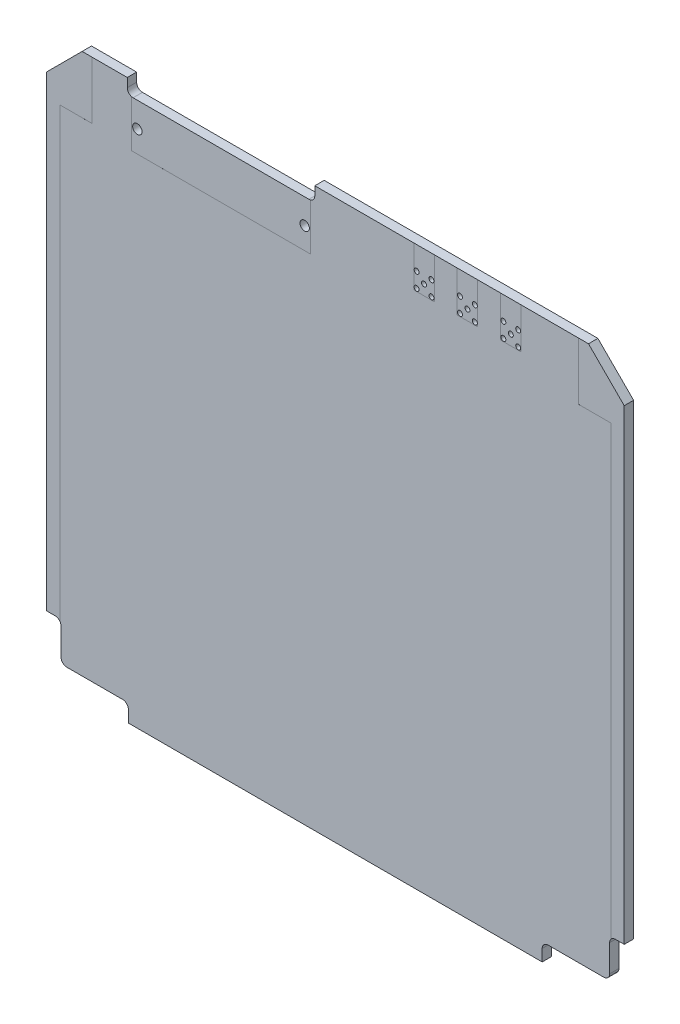
from build123d import *

# Parameters (mm, degrees)
SKETCH1_R           = 0.425
SKETCH1_R_2         = 0.8
BOSS_EXTRUDE1_DEPTH = 1.6
CUT_EXTRUDE1_DEPTH  = 0.0001
CUT_EXTRUDE2_DEPTH  = 0.0001
PARTFOOTPRINTS_W    = 30.48
PARTFOOTPRINTS_H    = 7.989227112
PARTFOOTPRINTS_W_2  = 3.5
PARTFOOTPRINTS_H_2  = 6.95
CUT_EXTRUDE3_DEPTH  = 0.0001


with BuildPart() as part:
    # Sketch1 → Boss-Extrude1 (new body)
    with BuildSketch(Plane(origin=(0, 0, -0.0125), x_dir=(-1, 0, 0), z_dir=(0, 0, -1))):
        with BuildLine():
            Line((35.3, -50), (35.3, -48))
            ThreePointArc((35.3, -48), (35.592893219, -47.292893219), (36.3, -47))
            Line((36.3, -47), (45.8, -47))
            ThreePointArc((45.8, -47), (46.507106781, -46.707106781), (46.8, -46))
            Line((46.8, -46), (46.8, -41.4))
            ThreePointArc((46.8, -41.4), (47.092893219, -40.692893219), (47.8, -40.4))
            Line((47.8, -40.4), (49.3, -40.4))
            Line((49.3, -40.4), (49.3, 39.2))
            Line((49.3, 39.2), (43.2, 45.3))
            Line((43.2, 45.3), (35.500000002, 45.3))
            Line((35.500000002, 45.3), (35.500000002, 43.8))
            ThreePointArc((35.500000002, 43.8), (35.207106783, 43.092893219), (34.500000002, 42.8))
            Line((34.500000002, 42.8), (4.499999998, 42.8))
            ThreePointArc((4.499999998, 42.8), (3.792893217, 43.092893219), (3.499999998, 43.8))
            Line((3.499999998, 43.8), (3.499999998, 45.3))
            Line((3.499999998, 45.3), (-43.2, 45.3))
            Line((-43.2, 45.3), (-49.3, 39.2))
            Line((-49.3, 39.2), (-49.3, -40.4))
            Line((-49.3, -40.4), (-47.8, -40.4))
            ThreePointArc((-47.8, -40.4), (-47.092893219, -40.692893219), (-46.8, -41.4))
            Line((-46.8, -41.4), (-46.8, -46))
            ThreePointArc((-46.8, -46), (-46.507106781, -46.707106781), (-45.8, -47))
            Line((-45.8, -47), (-36.3, -47))
            ThreePointArc((-36.3, -47), (-35.592893219, -47.292893219), (-35.3, -48))
            Line((-35.3, -48), (-35.3, -50))
            Line((-35.3, -50), (35.3, -50))
        make_face()
        with Locations(Location((-21.27, 41.37, 0), (0, 0, 180))):
            Circle(SKETCH1_R, mode=Mode.SUBTRACT)
        with Locations(Location((-23.81, 41.37, 0), (0, 0, 180))):
            Circle(SKETCH1_R, mode=Mode.SUBTRACT)
        with Locations(Location((-22.54, 40.1, 0), (0, 0, 180))):
            Circle(SKETCH1_R, mode=Mode.SUBTRACT)
        with Locations(Location((-13.87, 41.37, 0), (0, 0, 180))):
            Circle(SKETCH1_R, mode=Mode.SUBTRACT)
        with Locations(Location((-23.81, 38.83, 0), (0, 0, 180))):
            Circle(SKETCH1_R, mode=Mode.SUBTRACT)
        with Locations(Location((-16.41, 41.37, 0), (0, 0, 180))):
            Circle(SKETCH1_R, mode=Mode.SUBTRACT)
        with Locations(Location((-15.14, 40.1, 0), (0, 0, 180))):
            Circle(SKETCH1_R, mode=Mode.SUBTRACT)
        with Locations(Location((-21.27, 38.83, 0), (0, 0, 180))):
            Circle(SKETCH1_R, mode=Mode.SUBTRACT)
        with Locations(Location((-28.67, 41.37, 0), (0, 0, 180))):
            Circle(SKETCH1_R, mode=Mode.SUBTRACT)
        with Locations(Location((-31.21, 41.37, 0), (0, 0, 180))):
            Circle(SKETCH1_R, mode=Mode.SUBTRACT)
        with Locations(Location((-16.41, 38.83, 0), (0, 0, 180))):
            Circle(SKETCH1_R, mode=Mode.SUBTRACT)
        with Locations(Location((-29.94, 40.1, 0), (0, 0, 180))):
            Circle(SKETCH1_R, mode=Mode.SUBTRACT)
        with Locations(Location((-31.21, 38.83, 0), (0, 0, 180))):
            Circle(SKETCH1_R, mode=Mode.SUBTRACT)
        with Locations(Location((-28.67, 38.83, 0), (0, 0, 180))):
            Circle(SKETCH1_R, mode=Mode.SUBTRACT)
        with Locations(Location((33.775, 38.54, 0), (0, 0, 180))):
            Circle(SKETCH1_R_2, mode=Mode.SUBTRACT)
        with Locations((5.225, 38.54)):
            Circle(SKETCH1_R_2, mode=Mode.SUBTRACT)
        with Locations(Location((-13.87, 38.83, 0), (0, 0, 180))):
            Circle(SKETCH1_R, mode=Mode.SUBTRACT)
    extrude(amount=-BOSS_EXTRUDE1_DEPTH)

    # thermalContacts_lower → Cut-Extrude1 (cut)
    with BuildSketch(Plane(origin=(0, 0, -0.0125), x_dir=(-1, 0, 0), z_dir=(0, 0, -1))):
        Polygon((47, 35.5), (47, -41.5), (59.827263463, -41.5), (59.827263463, 47), (41.5, 47), (41.5, 41.5), (41.5, 35.5), align=None)
        Polygon((-47, 35.5), (-47, -41.5), (-56.192158269, -41.5), (-56.192158269, 47), (-41.5, 47), (-41.5, 41.5), (-41.5, 35.5), align=None)
    extrude(amount=-CUT_EXTRUDE1_DEPTH, mode=Mode.SUBTRACT)

    # thermalContacts_upper → Cut-Extrude2 (cut)
    with BuildSketch(Plane.XY.offset(1.5875)):
        Polygon((-47, 35.5), (-47, -41.5), (-56.192158269, -41.5), (-56.192158269, 47), (-41.5, 47), (-41.5, 41.5), (-41.5, 35.5), align=None)
        Polygon((47, 35.5), (47, -41.5), (59.827263463, -41.5), (59.827263463, 47), (41.5, 47), (41.5, 41.5), (41.5, 35.5), align=None)
    extrude(amount=-CUT_EXTRUDE2_DEPTH, mode=Mode.SUBTRACT)

    # partFootprints → Cut-Extrude3 (cut)
    with BuildSketch(Plane.XY.offset(1.5875)):
        with Locations((-19.5, 38.834613556)):
            Rectangle(PARTFOOTPRINTS_W, PARTFOOTPRINTS_H)
        with Locations((15.14, 41.825)):
            Rectangle(PARTFOOTPRINTS_W_2, PARTFOOTPRINTS_H_2)
        with Locations((22.54, 41.825)):
            Rectangle(PARTFOOTPRINTS_W_2, PARTFOOTPRINTS_H_2)
        with Locations((29.94, 41.825)):
            Rectangle(PARTFOOTPRINTS_W_2, PARTFOOTPRINTS_H_2)
    extrude(amount=-CUT_EXTRUDE3_DEPTH, mode=Mode.SUBTRACT)


solid = part.part
